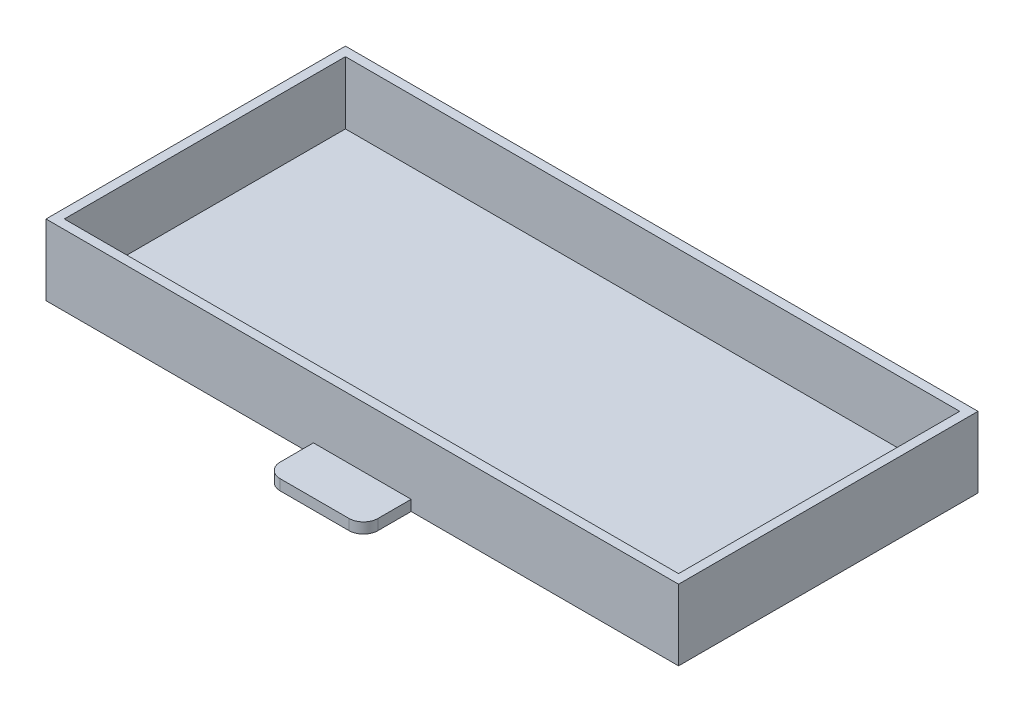
from build123d import *

# Parameters (mm, degrees)
SKETCH2_W           = 131.4
SKETCH2_H           = 62.2
BOSS_EXTRUDE1_DEPTH = 14.7
SKETCH3_W           = 127.6
SKETCH3_H           = 58.4
CUT_EXTRUDE1_DEPTH  = 13
SKETCH4_W           = 20.3
SKETCH4_H           = 9.9
BOSS_EXTRUDE2_DEPTH = 2.2
FILLET1_R           = 3


with BuildPart() as part:
    # Sketch2 → Boss-Extrude1 (new body)
    with BuildSketch(Plane(origin=(0, 0, 0), x_dir=(1, 0, 0), z_dir=(0, 1, 0))):
        Rectangle(SKETCH2_W, SKETCH2_H)
    extrude(amount=BOSS_EXTRUDE1_DEPTH)

    # Sketch3 → Cut-Extrude1 (cut)
    with BuildSketch(Plane(origin=(0, 14.7, 0), x_dir=(1, 0, 0), z_dir=(0, 1, 0))):
        Rectangle(SKETCH3_W, SKETCH3_H)
    extrude(amount=-CUT_EXTRUDE1_DEPTH, mode=Mode.SUBTRACT)

    # Sketch4 → Boss-Extrude2 (add)
    with BuildSketch(Plane.XZ):
        with Locations((0, 36.05)):
            Rectangle(SKETCH4_W, SKETCH4_H)
    extrude(amount=-BOSS_EXTRUDE2_DEPTH)

    # Fillet1
    fillet1_edges = [part.edges().sort_by_distance(p)[0] for p in [
        (-10.15, 1.1, 41),
        (10.15, 1.1, 41),
    ]]
    fillet(fillet1_edges, radius=FILLET1_R)


solid = part.part
